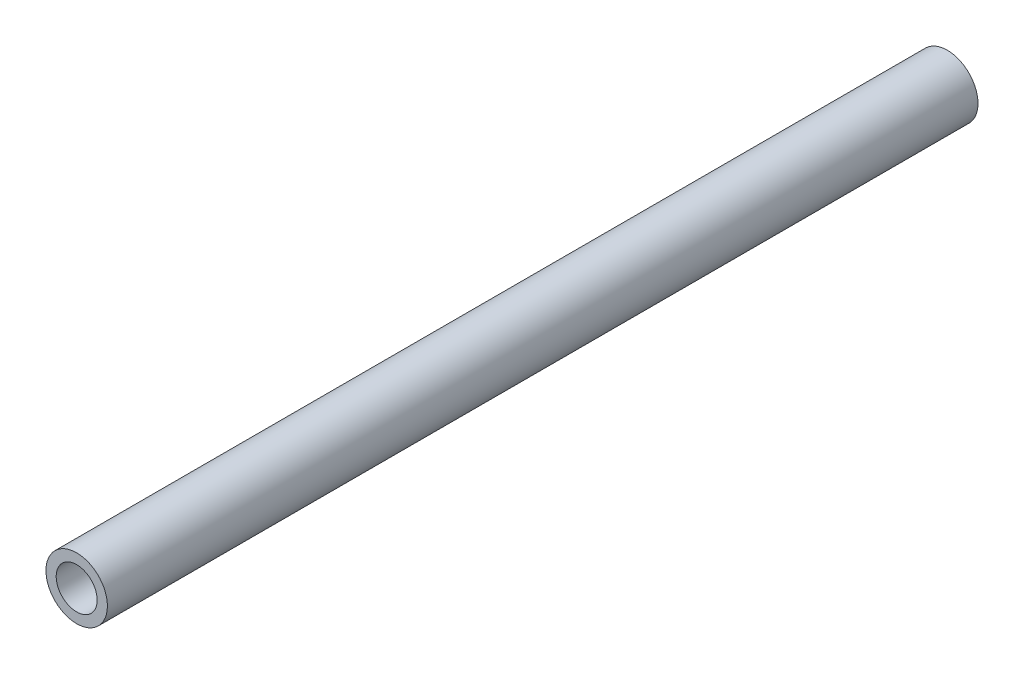
from build123d import *

# Parameters (mm, degrees)
SKETCH1_R           = 19.05
BOSS_EXTRUDE1_DEPTH = 539.75
SKETCH2_R           = 12.7
CUT_EXTRUDE1_DEPTH  = 539.75


with BuildPart() as part:
    # Sketch1 → Boss-Extrude1 (new body)
    with BuildSketch(Plane.XY):
        Circle(SKETCH1_R)
    extrude(amount=BOSS_EXTRUDE1_DEPTH)

    # Sketch2 → Cut-Extrude1 (cut)
    with BuildSketch(Plane.XY.offset(539.75)):
        Circle(SKETCH2_R)
    extrude(amount=-CUT_EXTRUDE1_DEPTH, mode=Mode.SUBTRACT)


solid = part.part
